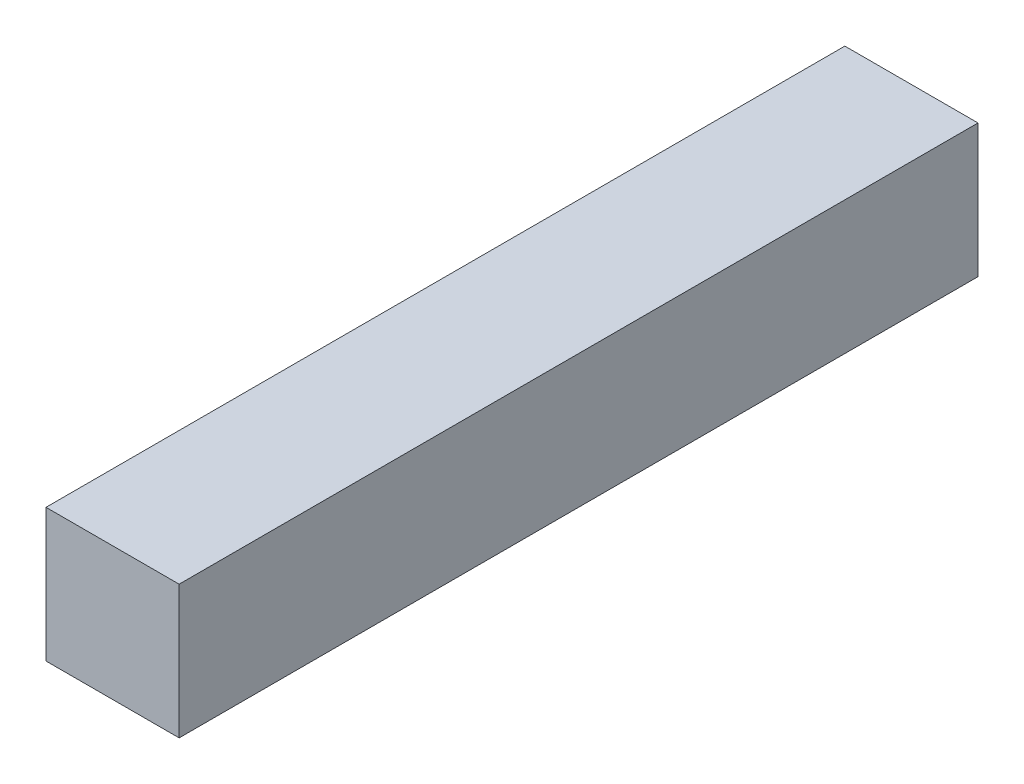
from build123d import *

# Parameters (mm, degrees)
SKETCH2_W           = 25
SKETCH2_H           = 25
BOSS_EXTRUDE1_DEPTH = 75


with BuildPart() as part:
    # Sketch2 → Boss-Extrude1 (new, symmetric)
    with BuildSketch(Plane.XY):
        Rectangle(SKETCH2_W, SKETCH2_H)
    extrude(amount=BOSS_EXTRUDE1_DEPTH, both=True)


solid = part.part
